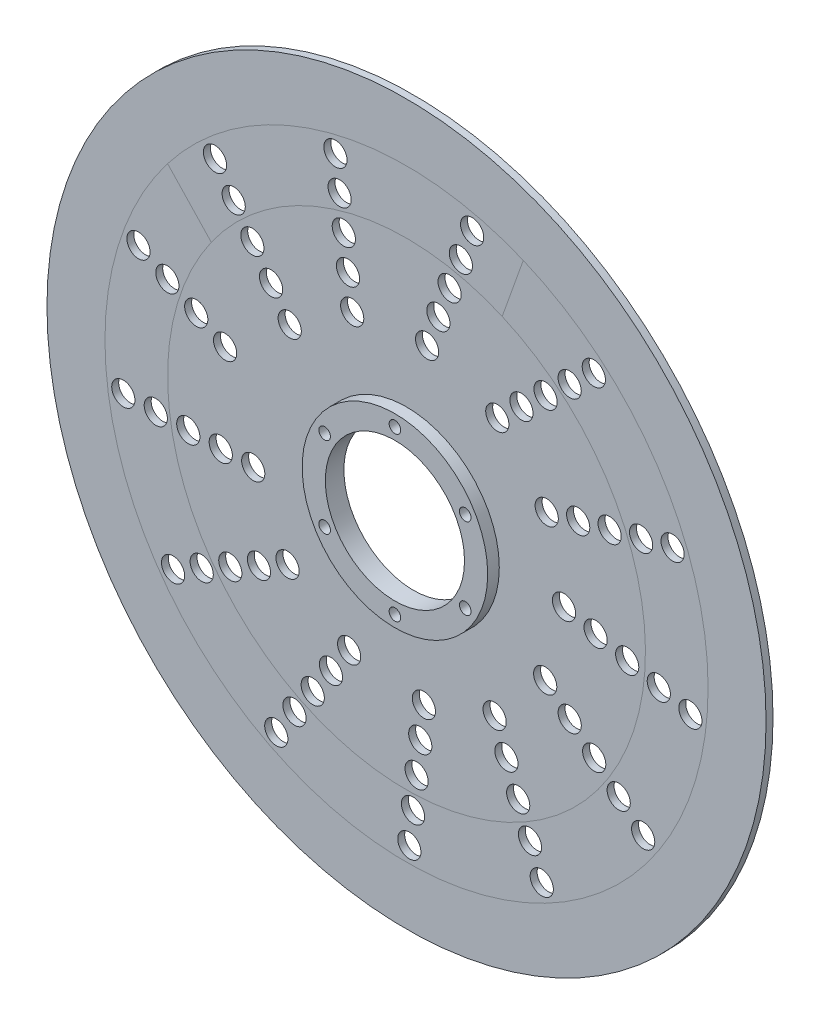
from build123d import *

# Parameters (mm, degrees)
SKETCH1_R           = 155
SKETCH1_R_2         = 30
EXTRUDE_THIN1_DEPTH = 3
SKETCH3_R           = 40
SKETCH3_R_2         = 30
EXTRUDE_THIN2_DEPTH = 5
SKETCH7_R           = 5
CUT_EXTRUDE3_DEPTH  = 220.260119493
SKETCH9_R           = 2.5
CUT_EXTRUDE4_DEPTH  = 220.349036925


with BuildPart() as part:
    # Sketch1 → Extrude-Thin1 (new body)
    with BuildSketch(Plane.XY):
        Circle(SKETCH1_R)
        Circle(SKETCH1_R_2, mode=Mode.SUBTRACT)
    extrude(amount=EXTRUDE_THIN1_DEPTH)

    # Sketch3 → Extrude-Thin2 (add)
    with BuildSketch(Plane.XY.offset(3)):
        Circle(SKETCH3_R)
        Circle(SKETCH3_R_2, mode=Mode.SUBTRACT)
    extrude(amount=EXTRUDE_THIN2_DEPTH)

    # Sketch7 → Cut-Extrude3 (cut, through all)
    with BuildSketch(Plane.XY.offset(3)):
        with Locations((-50.351181472, 45.541803602)):
            Circle(SKETCH7_R)
        with Locations((-58.402643714, 56.994923516)):
            Circle(SKETCH7_R)
        with Locations((-66.454105956, 68.44804343)):
            Circle(SKETCH7_R)
        with Locations((-74.505568198, 79.901163345)):
            Circle(SKETCH7_R)
        with Locations((-82.55703044, 91.354283259)):
            Circle(SKETCH7_R)
        with Locations((-23.419425603, 63.724625189)):
            Circle(SKETCH7_R)
        with Locations((-25.226111144, 77.607560302)):
            Circle(SKETCH7_R)
        with Locations((-27.032796685, 91.490495415)):
            Circle(SKETCH7_R)
        with Locations((-28.839482226, 105.373430528)):
            Circle(SKETCH7_R)
        with Locations((-30.646167767, 119.256365641)):
            Circle(SKETCH7_R)
        with Locations((8.877438438, 67.308903109)):
            Circle(SKETCH7_R)
        with Locations((13.729419482, 80.441240295)):
            Circle(SKETCH7_R)
        with Locations((18.581400526, 93.57357748)):
            Circle(SKETCH7_R)
        with Locations((23.43338157, 106.705914665)):
            Circle(SKETCH7_R)
        with Locations((28.285362614, 119.83825185)):
            Circle(SKETCH7_R)
        with Locations((39.140588317, 55.473522488)):
            Circle(SKETCH7_R)
        with Locations((49.539705562, 64.846801558)):
            Circle(SKETCH7_R)
        with Locations((59.938822807, 74.220080628)):
            Circle(SKETCH7_R)
        with Locations((70.337940052, 83.593359698)):
            Circle(SKETCH7_R)
        with Locations((80.737057297, 92.966638768)):
            Circle(SKETCH7_R)
        with Locations((60.437101108, 30.929826393)):
            Circle(SKETCH7_R)
        with Locations((74.001042116, 34.396742073)):
            Circle(SKETCH7_R)
        with Locations((87.564983124, 37.863657753)):
            Circle(SKETCH7_R)
        with Locations((101.128924132, 41.330573433)):
            Circle(SKETCH7_R)
        with Locations((114.69286514, 44.797489113)):
            Circle(SKETCH7_R)
        with Locations((67.888202381, -0.699520184)):
            Circle(SKETCH7_R)
        with Locations((81.50963173, -3.933196495)):
            Circle(SKETCH7_R)
        with Locations((95.131061079, -7.166872806)):
            Circle(SKETCH7_R)
        with Locations((108.752490428, -10.400549118)):
            Circle(SKETCH7_R)
        with Locations((122.373919778, -13.634225429)):
            Circle(SKETCH7_R)
        with Locations((59.78693463, -32.168615117)):
            Circle(SKETCH7_R)
        with Locations((70.345347013, -41.362087146)):
            Circle(SKETCH7_R)
        with Locations((80.903759395, -50.555559176)):
            Circle(SKETCH7_R)
        with Locations((91.462171778, -59.749031206)):
            Circle(SKETCH7_R)
        with Locations((102.02058416, -68.942503236)):
            Circle(SKETCH7_R)
        with Locations((37.989200666, -56.268268)):
            Circle(SKETCH7_R)
        with Locations((43.065791048, -69.3154221)):
            Circle(SKETCH7_R)
        with Locations((48.14238143, -82.362576199)):
            Circle(SKETCH7_R)
        with Locations((53.218971811, -95.409730299)):
            Circle(SKETCH7_R)
        with Locations((58.295562193, -108.456884398)):
            Circle(SKETCH7_R)
        with Locations((7.488598649, -67.477538791)):
            Circle(SKETCH7_R)
        with Locations((5.920381353, -81.389429191)):
            Circle(SKETCH7_R)
        with Locations((4.352164057, -95.301319592)):
            Circle(SKETCH7_R)
        with Locations((2.783946761, -109.213209992)):
            Circle(SKETCH7_R)
        with Locations((1.215729465, -123.125100392)):
            Circle(SKETCH7_R)
        with Locations((-24.727551071, -63.228518637)):
            Circle(SKETCH7_R)
        with Locations((-32.581316361, -74.818098904)):
            Circle(SKETCH7_R)
        with Locations((-40.435081651, -86.407679171)):
            Circle(SKETCH7_R)
        with Locations((-48.288846942, -97.997259438)):
            Circle(SKETCH7_R)
        with Locations((-56.142612232, -109.586839705)):
            Circle(SKETCH7_R)
        with Locations((-51.27891684, -44.49460685)):
            Circle(SKETCH7_R)
        with Locations((-63.619027145, -51.106843814)):
            Circle(SKETCH7_R)
        with Locations((-75.959137449, -57.719080778)):
            Circle(SKETCH7_R)
        with Locations((-88.299247754, -64.331317742)):
            Circle(SKETCH7_R)
        with Locations((-100.639358059, -70.943554706)):
            Circle(SKETCH7_R)
        with Locations((-66.082900739, -15.567516851)):
            Circle(SKETCH7_R)
        with Locations((-80.082385502, -15.68762671)):
            Circle(SKETCH7_R)
        with Locations((-94.081870264, -15.807736569)):
            Circle(SKETCH7_R)
        with Locations((-108.081355027, -15.927846427)):
            Circle(SKETCH7_R)
        with Locations((-122.08083979, -16.047956286)):
            Circle(SKETCH7_R)
        with Locations((-78.199834438, 23.325436617)):
            Circle(SKETCH7_R)
        with Locations((-90.651580411, 29.724969584)):
            Circle(SKETCH7_R)
        with Locations((-103.103326385, 36.124502552)):
            Circle(SKETCH7_R)
        with Locations((-115.555072359, 42.52403552)):
            Circle(SKETCH7_R)
    extrude(amount=-CUT_EXTRUDE3_DEPTH, mode=Mode.SUBTRACT)

    # Sketch9 → Cut-Extrude4 (cut, through all)
    with BuildSketch(Plane.XY.offset(8)):
        with Locations((0, 35)):
            Circle(SKETCH9_R)
        with Locations((30.310889132, 17.5)):
            Circle(SKETCH9_R)
        with Locations((30.310889132, -17.5)):
            Circle(SKETCH9_R)
        with Locations((0, -35)):
            Circle(SKETCH9_R)
        with Locations((-30.310889132, -17.5)):
            Circle(SKETCH9_R)
        with Locations((-30.310889132, 17.5)):
            Circle(SKETCH9_R)
    extrude(amount=-CUT_EXTRUDE4_DEPTH, mode=Mode.SUBTRACT)


solid = part.part
